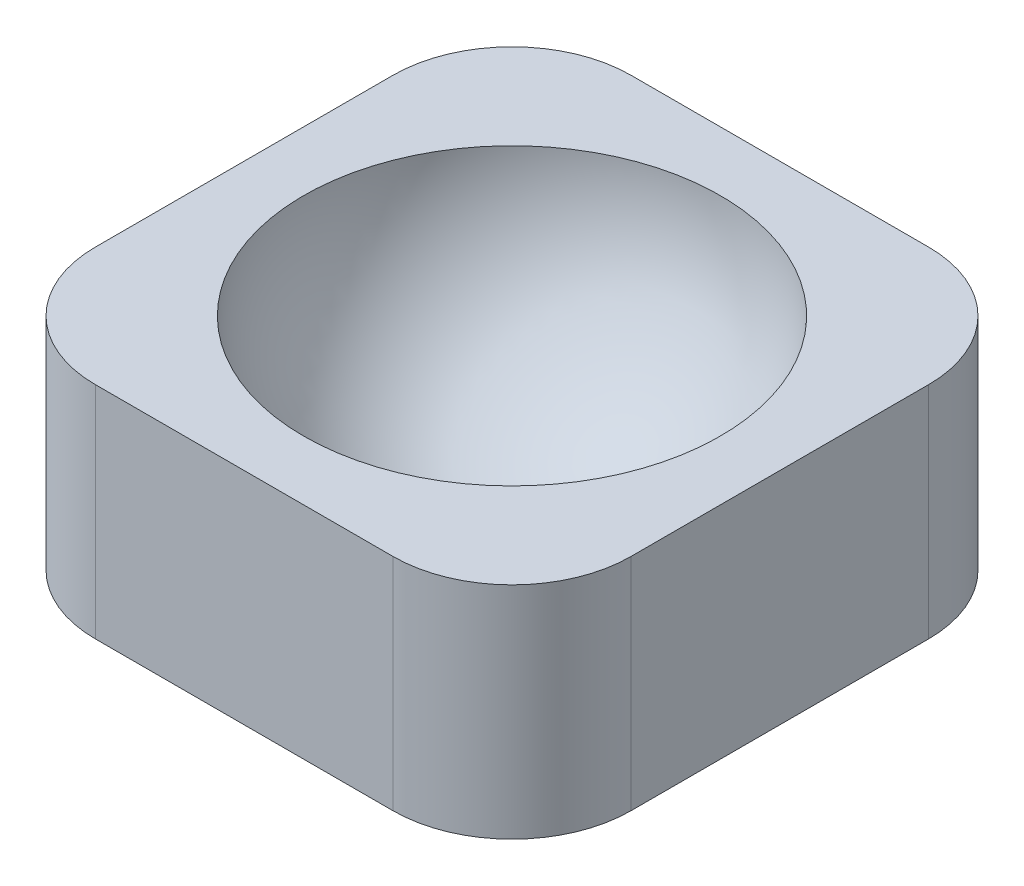
from build123d import *
from build123d.topology import SkipClean

# Parameters (mm, degrees)
SKETCH1_W           = 114.3
SKETCH1_H           = 114.3
SKETCH1_R           = 44.45
BOSS_EXTRUDE1_DEPTH = 46.99
CUT_REVOLVE1_ANGLE  = 180
FILLET1_R           = 25.4


with BuildPart() as part:
    # Sketch1 → Boss-Extrude1 (new body)
    # profile 1 of 2: a face of its own
    with BuildSketch(Plane(origin=(0, 0, 0), x_dir=(1, 0, 0), z_dir=(0, 1, 0))):
        with Locations((-57.15, 57.15)):
            Rectangle(SKETCH1_W, SKETCH1_H)
        with Locations((-57.15, 57.15)):
            Circle(SKETCH1_R, mode=Mode.SUBTRACT)
    # profile 2 of 2: a face of its own
    with BuildSketch(Plane(origin=(0, 0, 0), x_dir=(1, 0, 0), z_dir=(0, 1, 0))):
        with Locations((-57.15, 57.15)):
            Circle(SKETCH1_R)
    extrude(amount=BOSS_EXTRUDE1_DEPTH)

    # Sketch2 → Cut-Revolve1 (revolve, cut)
    with SkipClean():  # the faces are left unmerged after this step: merging them gives an invalid solid
        with BuildSketch(Plane(origin=(0, 46.99, 0), x_dir=(1, 0, 0), z_dir=(0, 1, 0))):
            with BuildLine():
                ThreePointArc((-12.7, 57.15), (-25.719103576, 88.580896424), (-57.15, 101.6))
                Line((-57.15, 101.6), (-57.15, 12.7))
                ThreePointArc((-57.15, 12.7), (-25.719103576, 25.719103576), (-12.7, 57.15))
            make_face()
            with BuildLine():
                Line((-57.15, 12.7), (-57.15, 101.6))
                ThreePointArc((-57.15, 101.6), (-101.6, 57.15), (-57.15, 12.7))
            make_face()
        revolve(axis=Axis((-57.15, 46.99, -114.3), (0, 0, 1)), revolution_arc=CUT_REVOLVE1_ANGLE, mode=Mode.SUBTRACT)

    # Fillet1
    fillet1_edges = [part.edges().sort_by_distance(p)[0] for p in [
        (-114.3, 23.495, -114.3),
        (0, 23.495, -114.3),
        (0, 23.495, 0),
        (-114.3, 23.495, 0),
    ]]
    fillet(fillet1_edges, radius=FILLET1_R)


solid = part.part
